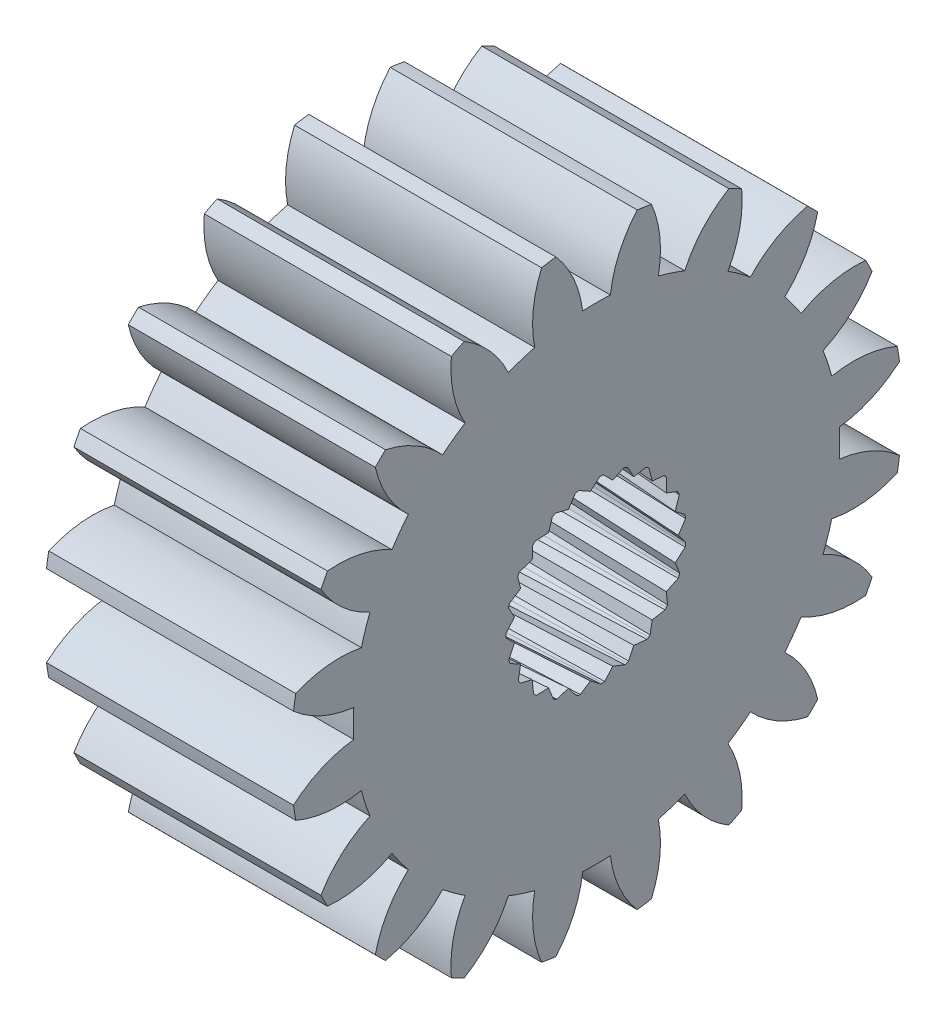
from build123d import *

# Parameters (mm, degrees)
BASPROSKE_W        = 8
BASPROSKE_H        = 9.9
TOOTHCUT_DEPTH     = 17.125135658
TEETHCUTS_COUNT    = 20
TEETHCUTS_ANGLE    = 342
BORSKE_R           = 0.4
BORE_DEPTH         = 50.0000508
CUT_EXTRUDE1_DEPTH = 10
CUT_EXTRUDE1_TAPER = -3


with BuildPart() as part:
    # BasProSke → Base-Revolve (revolve)
    with BuildSketch(Plane(origin=(0, 0, 0), x_dir=(1, 0, 0), z_dir=(0, 1, 0)), mode=Mode.PRIVATE) as base_revolve_sk:
        with Locations((4, 4.95)):
            Rectangle(BASPROSKE_W, BASPROSKE_H)
    revolve(base_revolve_sk.sketch.rotate(Axis((-10, 0, 0), (1, 0, 0)), 180), axis=Axis((-10, 0, 0), (1, 0, 0)))

    # TooCutSke → ToothCut (cut, through all)
    with BuildSketch(Plane(origin=(0, 0, 0), x_dir=(0, 0, -1), z_dir=(1, 0, 0))):
        with BuildLine():
            ThreePointArc((0.449613328, 7.861152832), (0, 7.874), (-0.449613328, 7.861152832))
            ThreePointArc((-0.449613328, 7.861152832), (-0.742132333, 8.916327712), (-1.33832794, 9.83475691))
            ThreePointArc((-1.33832794, 9.83475691), (0, 9.9254), (1.33832794, 9.83475691))
            ThreePointArc((1.33832794, 9.83475691), (0.742132333, 8.916327712), (0.449613328, 7.861152832))
        make_face()
    toothcut = extrude(amount=TOOTHCUT_DEPTH, mode=Mode.SUBTRACT)

    # TeethCuts: ToothCut ×20 about axis
    teethcuts_axis = Axis((-10, 0, 0), (1, 0, 0))
    for i in range(1, TEETHCUTS_COUNT):
        add(toothcut.rotate(teethcuts_axis, i * TEETHCUTS_ANGLE / (TEETHCUTS_COUNT - 1)), mode=Mode.SUBTRACT)

    # BorSke → Bore (cut, symmetric)
    with BuildSketch(Plane(origin=(0, 0, 0), x_dir=(0, 0, -1), z_dir=(1, 0, 0))):
        with Locations(Location((0, 0, 0), (0, 0, 180))):
            Circle(BORSKE_R)
    extrude(amount=BORE_DEPTH, both=True, mode=Mode.SUBTRACT)

    # Sketch1 → Cut-Extrude1 (cut)
    with BuildSketch(Plane(origin=(8, 0, 0), x_dir=(0, 0, -1), z_dir=(1, 0, 0))):
        Polygon((-2.934049215, 0.063273506), (-2.938377242, 0), (-2.934049215, -0.063273506), (-2.655091416, -0.342231306), (-2.837390694, -0.725551953), (-2.824487238, -0.787646794), (-2.803248718, -0.84740626), (-2.459373518, -1.040757633), (-2.531493971, -1.459047468), (-2.502316022, -1.515358353), (-2.465742174, -1.567171692), (-2.082453222, -1.660576653), (-2.039046006, -2.082813031), (-1.99575756, -2.12916364), (-1.946560898, -2.169188093), (-1.552284983, -2.155719223), (-1.396569413, -2.550586805), (-1.342380976, -2.583539524), (-1.284210191, -2.608806661), (-0.908188954, -2.489462885), (-0.651713741, -2.827676147), (-0.590644221, -2.844787025), (-0.527813575, -2.853422898), (-0.197934791, -2.637055397), (0.140278472, -2.89353061), (0.203699828, -2.89353061), (0.266530474, -2.884894737), (0.525801205, -2.587550499), (0.920668786, -2.743266069), (0.981738307, -2.726155192), (1.039909091, -2.700888055), (1.209342845, -2.344619742), (1.631579223, -2.388026958), (1.685767661, -2.355074239), (1.734964323, -2.315049786), (1.801994973, -1.926280189), (2.220284808, -1.854159736), (2.263573254, -1.807809128), (2.300147102, -1.755995789), (2.259803291, -1.36355817), (2.643123939, -1.181258893), (2.672301888, -1.124948008), (2.693540407, -1.065188542), (2.548814252, -0.698188205), (2.868736574, -0.419230406), (2.88164003, -0.357135565), (2.885968056, -0.293862059), (2.647593234, 0.020482261), (2.880390055, 0.375409558), (2.876062028, 0.438683064), (2.863158572, 0.500777905), (2.548814252, 0.739152728), (2.677220096, 1.143726188), (2.655981577, 1.203485653), (2.626803629, 1.259796538), (2.259803291, 1.404522693), (2.274294885, 1.828736954), (2.237721037, 1.880550293), (2.194432591, 1.926900901), (1.801994973, 1.967244711), (1.701497541, 2.379637742), (1.652300879, 2.419662195), (1.598112442, 2.452614914), (1.209342845, 2.385584264), (1.001309823, 2.755570761), (0.943139038, 2.780837898), (0.882069518, 2.797948775), (0.525801205, 2.628515022), (0.225661449, 2.928654777), (0.162830803, 2.937290651), (0.099409447, 2.937290651), (-0.197934791, 2.67801992), (-0.567921287, 2.886052942), (-0.630751933, 2.877417069), (-0.691821453, 2.860306191), (-0.908188954, 2.530427408), (-1.320581985, 2.630924839), (-1.37875277, 2.605657702), (-1.432941207, 2.572704983), (-1.552284983, 2.196683746), (-1.976499244, 2.182192152), (-2.025695906, 2.142167698), (-2.068984353, 2.09581709), (-2.082453222, 1.701541176), (-2.487026682, 1.573135331), (-2.52360053, 1.521321993), (-2.552778479, 1.465011108), (-2.459373518, 1.081722156), (-2.814300814, 0.848925335), (-2.835539333, 0.78916587), (-2.84844279, 0.727071029), (-2.655091416, 0.383195828), align=None)
    extrude(amount=-CUT_EXTRUDE1_DEPTH, taper=CUT_EXTRUDE1_TAPER, mode=Mode.SUBTRACT)


solid = part.part
